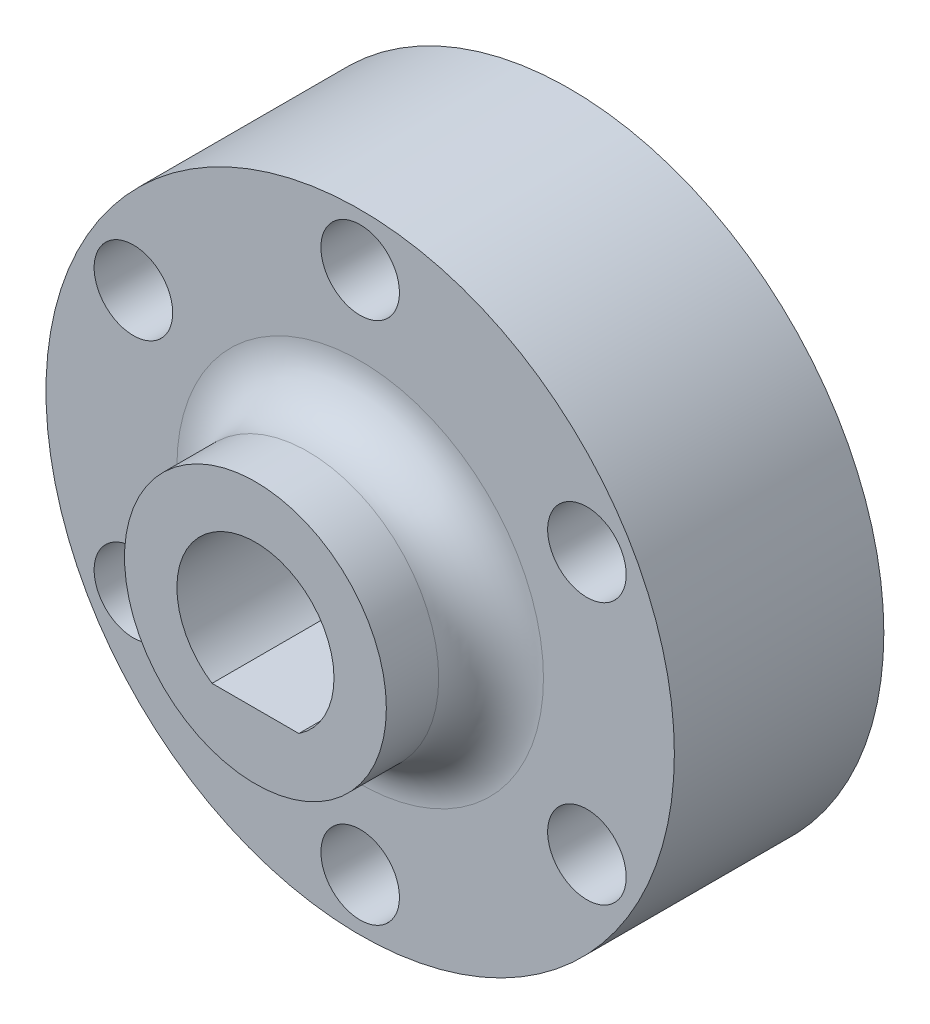
from build123d import *
from build123d.topology import SkipClean

# Parameters (mm, degrees)
SKETCH1_R                       = 12
SKETCH1_R_2                     = 1.5
SKETCH1_R_3                     = 3
BOSS_EXTRUDE1_DEPTH             = 8
SKETCH2_R                       = 5
BOSS_EXTRUDE2_DEPTH             = 4
BOSS_EXTRUDE2_DIRECTION_2_REACH = 20.762
FILLET1_R                       = 2


with BuildPart() as part:
    # Sketch1 → Boss-Extrude1 (new body)
    with BuildSketch(Plane.XY):
        Circle(SKETCH1_R)
        with Locations((0, 10)):
            Circle(SKETCH1_R_2, mode=Mode.SUBTRACT)
        Circle(SKETCH1_R_3, mode=Mode.SUBTRACT)
        with Locations((8.660254038, 5)):
            Circle(SKETCH1_R_2, mode=Mode.SUBTRACT)
        with Locations((8.660254038, -5)):
            Circle(SKETCH1_R_2, mode=Mode.SUBTRACT)
        with Locations((0, -10)):
            Circle(SKETCH1_R_2, mode=Mode.SUBTRACT)
        with Locations((-8.660254038, -5)):
            Circle(SKETCH1_R_2, mode=Mode.SUBTRACT)
        with Locations((-8.660254038, 5)):
            Circle(SKETCH1_R_2, mode=Mode.SUBTRACT)
    extrude(amount=BOSS_EXTRUDE1_DEPTH)

    # Sketch2 → Boss-Extrude2 (add)
    with SkipClean():  # the faces are left unmerged after this step: merging them gives an invalid solid
        with BuildSketch(Plane.XY.offset(8)):
            Circle(SKETCH2_R)
            with BuildLine():
                Line((1.658312395, -2.5), (-1.658312395, -2.5))
                ThreePointArc((-1.658312395, -2.5), (0, 3), (1.658312395, -2.5))
            make_face(mode=Mode.SUBTRACT)
        extrude(amount=BOSS_EXTRUDE2_DEPTH)

    # Boss-Extrude2 direction 2: up to this face of the body (flat: up to its plane)
    boss_extrude2_direction_2_end = Plane(part.part.faces().sort_by_distance((-11.660588745, 0, 0))[0])
    # Sketch2 → Boss-Extrude2 direction 2 (add, up to the picked face)
    with BuildSketch(Plane.XY.offset(8), mode=Mode.PRIVATE) as boss_extrude2_direction_2_sk1:
        Circle(SKETCH2_R)
        with BuildLine():
            Line((1.658312395, -2.5), (-1.658312395, -2.5))
            ThreePointArc((-1.658312395, -2.5), (0, 3), (1.658312395, -2.5))
        make_face(mode=Mode.SUBTRACT)
    boss_extrude2_direction_2_tool1 = split(extrude(boss_extrude2_direction_2_sk1.sketch, amount=-BOSS_EXTRUDE2_DIRECTION_2_REACH, mode=Mode.PRIVATE), bisect_by=boss_extrude2_direction_2_end, keep=Keep.BOTH, mode=Mode.PRIVATE)
    add(boss_extrude2_direction_2_tool1.solids().sort_by(Axis((-4.858579, 0, 8), (0, 0, -1)))[0])

    # Fillet1
    fillet1_edges = [part.edges().sort_by_distance(p)[0] for p in [
        (-5, 0, 8),
    ]]
    fillet(fillet1_edges, radius=FILLET1_R)


solid = part.part
